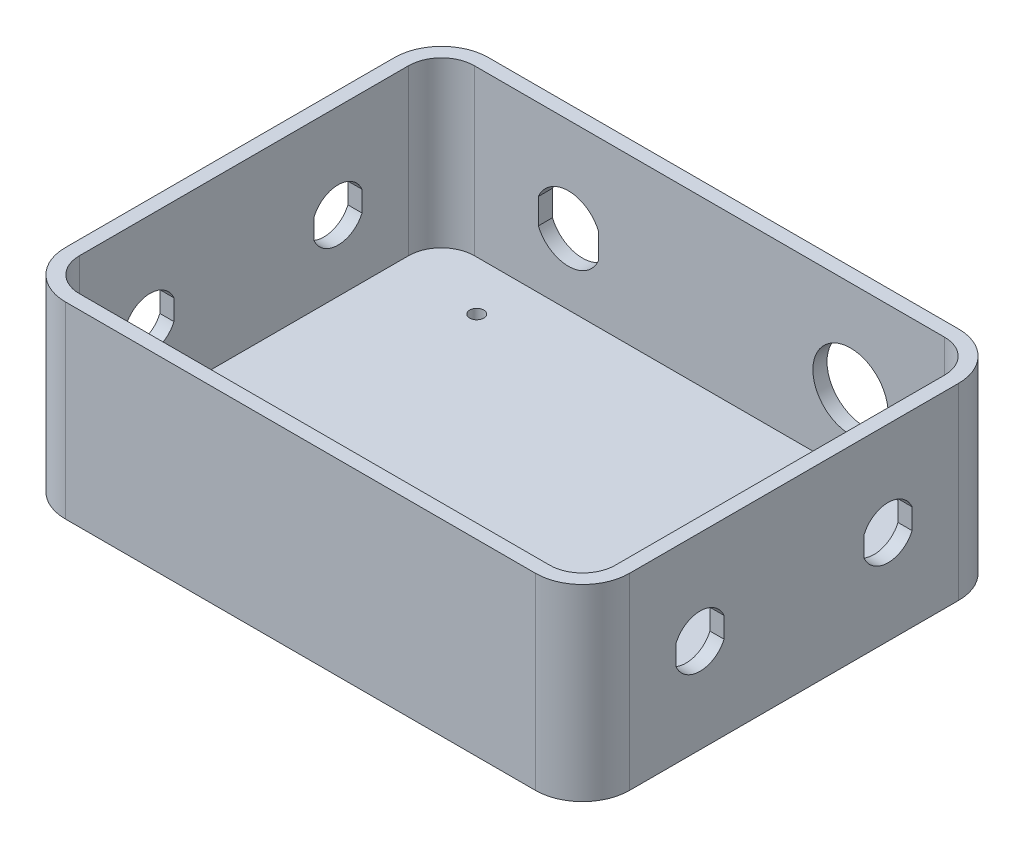
from build123d import *

# Parameters (mm, degrees)
BOSS_EXTRUDE1_DEPTH          = 5
F_3_0_3_DIAMETER_HOLE1_D     = 3
F_3_0_3_DIAMETER_HOLE1_DEPTH = 3
F_3_0_3_DIAMETER_HOLE1_TIP   = 0.901290929
BOSS_EXTRUDE2_DEPTH          = 35
CUT_EXTRUDE1_DEPTH           = 149
CUT_EXTRUDE2_DEPTH           = 35
SKETCH10_R                   = 8
CUT_EXTRUDE3_DEPTH           = 35


with BuildPart() as part:
    # Sketch1 → Boss-Extrude1 (new body)
    with BuildSketch(Plane(origin=(0, 0, 0), x_dir=(1, 0, 0), z_dir=(0, 1, 0))):
        with BuildLine():
            Line((10, 0), (110, 0))
            ThreePointArc((110, 0), (117.071067812, 2.928932188), (120, 10))
            Line((120, 10), (120, 80))
            ThreePointArc((120, 80), (117.071067812, 87.071067812), (110, 90))
            Line((110, 90), (10, 90))
            ThreePointArc((10, 90), (2.928932188, 87.071067812), (0, 80))
            Line((0, 80), (0, 10))
            ThreePointArc((0, 10), (2.928932188, 2.928932188), (10, 0))
        make_face()
    extrude(amount=BOSS_EXTRUDE1_DEPTH)

    # Ø3.0 (3) Diameter Hole1
    with Locations(Plane(origin=(0, 5, 0), x_dir=(1, 0, 0), z_dir=(0, 1, 0))):
        with Locations((99, 76.5), (21, 76.5), (21, 13.5), (99, 13.5)):
            Hole(F_3_0_3_DIAMETER_HOLE1_D / 2, depth=F_3_0_3_DIAMETER_HOLE1_DEPTH)
            with Locations((0, 0, -(F_3_0_3_DIAMETER_HOLE1_DEPTH + F_3_0_3_DIAMETER_HOLE1_TIP / 2))):  # 118° drill point
                Cone(0, F_3_0_3_DIAMETER_HOLE1_D / 2, F_3_0_3_DIAMETER_HOLE1_TIP, mode=Mode.SUBTRACT)

    # Sketch7 → Boss-Extrude2 (add)
    with BuildSketch(Plane(origin=(0, 5, 0), x_dir=(1, 0, 0), z_dir=(0, 1, 0))):
        with BuildLine():
            Line((10, 0), (110, 0))
            ThreePointArc((110, 0), (117.071067812, 2.928932188), (120, 10))
            Line((120, 10), (120, 80))
            ThreePointArc((120, 80), (117.071067812, 87.071067812), (110, 90))
            Line((110, 90), (10, 90))
            ThreePointArc((10, 90), (2.928932188, 87.071067812), (0, 80))
            Line((0, 80), (0, 10))
            ThreePointArc((0, 10), (2.928932188, 2.928932188), (10, 0))
        make_face()
        with BuildLine():
            Line((3, 80), (3, 10))
            ThreePointArc((3, 10), (5.050252532, 5.050252532), (10, 3))
            Line((10, 3), (110, 3))
            ThreePointArc((110, 3), (114.949747468, 5.050252532), (117, 10))
            Line((117, 10), (117, 80))
            ThreePointArc((117, 80), (114.949747468, 84.949747468), (110, 87))
            Line((110, 87), (10, 87))
            ThreePointArc((10, 87), (5.050252532, 84.949747468), (3, 80))
        make_face(mode=Mode.SUBTRACT)
    extrude(amount=BOSS_EXTRUDE2_DEPTH)

    # Sketch8 → Cut-Extrude1 (cut)
    with BuildSketch(Plane.ZY):
        with BuildLine():
            Line((-59.9, 22.189177928), (-59.9, 17.810822072))
            ThreePointArc((-59.9, 17.810822072), (-65, 14.45), (-70.1, 17.810822072))
            Line((-70.1, 17.810822072), (-70.1, 22.189177928))
            ThreePointArc((-70.1, 22.189177928), (-65, 25.55), (-59.9, 22.189177928))
        make_face()
        with BuildLine():
            Line((-19.9, 22.189177928), (-19.9, 17.810822072))
            ThreePointArc((-19.9, 17.810822072), (-25, 14.45), (-30.1, 17.810822072))
            Line((-30.1, 17.810822072), (-30.1, 22.189177928))
            ThreePointArc((-30.1, 22.189177928), (-25, 25.55), (-19.9, 22.189177928))
        make_face()
    extrude(amount=-CUT_EXTRUDE1_DEPTH, mode=Mode.SUBTRACT)

    # Sketch9 → Cut-Extrude2 (cut)
    with BuildSketch(Plane(origin=(0, 0, -90), x_dir=(-1, 0, 0), z_dir=(0, 0, -1))):
        with BuildLine():
            Line((-36.4, 22.709704781), (-36.4, 17.290295219))
            ThreePointArc((-36.4, 17.290295219), (-30, 13.05), (-23.6, 17.290295219))
            Line((-23.6, 17.290295219), (-23.6, 22.709704781))
            ThreePointArc((-23.6, 22.709704781), (-30, 26.95), (-36.4, 22.709704781))
        make_face()
    extrude(amount=-CUT_EXTRUDE2_DEPTH, mode=Mode.SUBTRACT)

    # Sketch10 → Cut-Extrude3 (cut)
    with BuildSketch(Plane(origin=(0, 0, -90), x_dir=(-1, 0, 0), z_dir=(0, 0, -1))):
        with Locations((-90, 20)):
            Circle(SKETCH10_R)
    extrude(amount=-CUT_EXTRUDE3_DEPTH, mode=Mode.SUBTRACT)


solid = part.part
